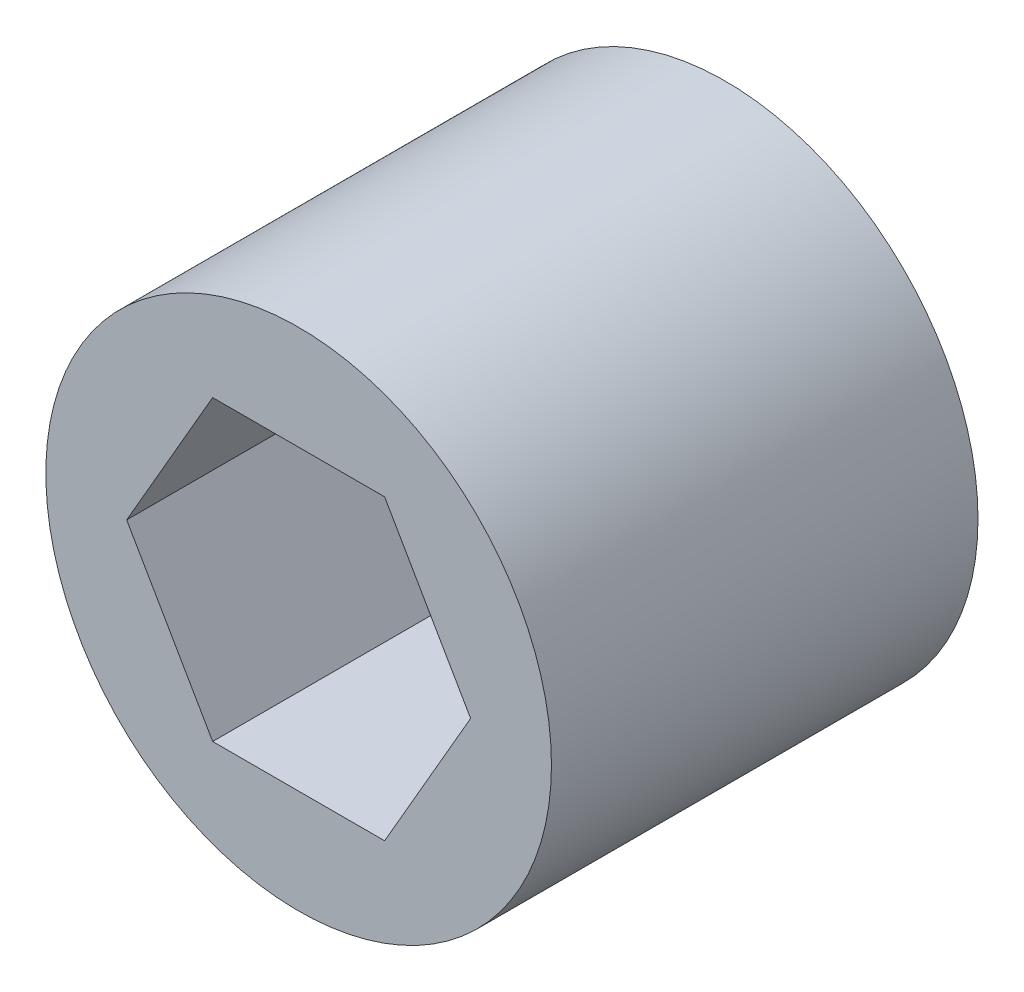
from build123d import *

# Parameters (mm, degrees)
SKETCH1_R           = 8.73125
BOSS_EXTRUDE1_DEPTH = 14.732


with BuildPart() as part:
    # Sketch1 → Boss-Extrude1 (new body)
    with BuildSketch(Plane.XY):
        Circle(SKETCH1_R)
        Polygon((5.939202219, 0), (2.96960111, 5.1435), (-2.96960111, 5.1435), (-5.939202219, 0), (-2.96960111, -5.1435), (2.96960111, -5.1435), align=None, mode=Mode.SUBTRACT)
    extrude(amount=BOSS_EXTRUDE1_DEPTH)


solid = part.part
